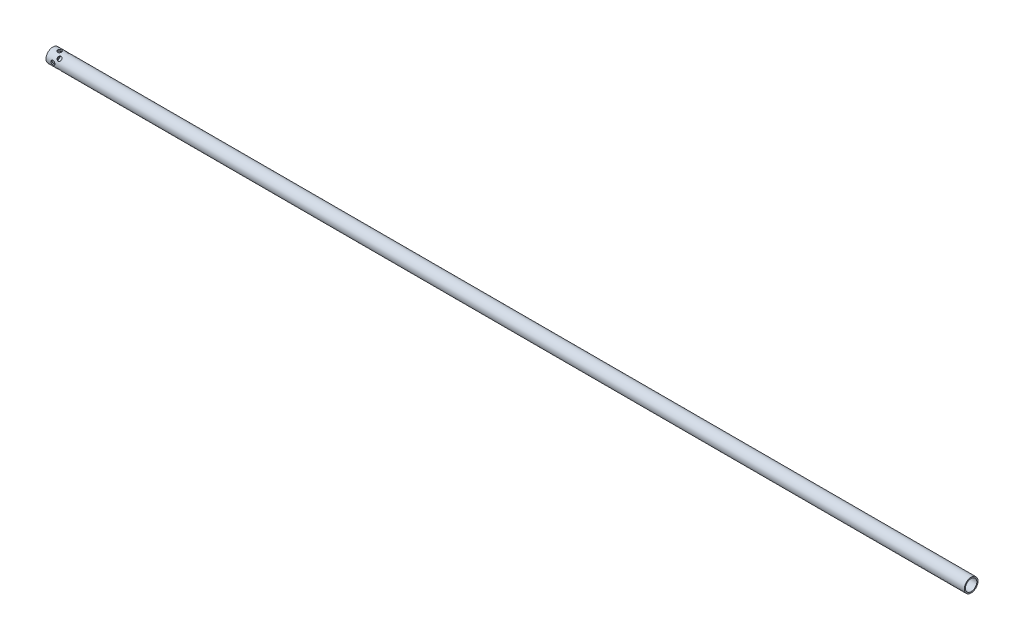
from build123d import *

# Parameters (mm, degrees)
SKETCH1_R           = 9.525
SKETCH1_R_2         = 7.874
BOSS_EXTRUDE1_DEPTH = 1270
BOSS_EXTRUDE2_START = -3.175
SKETCH2_R           = 9.525
BOSS_EXTRUDE2_DEPTH = 3.175
SKETCH3_R           = 2.778125
CUT_EXTRUDE1_DEPTH  = 12.7
CIRPATTERN1_COUNT   = 2
CIRPATTERN1_ANGLE   = 90
SKETCH4_R           = 2.778125
CUT_EXTRUDE2_DEPTH  = 12.7
CIRPATTERN2_COUNT   = 2
CIRPATTERN2_ANGLE   = 90


with BuildPart() as part:
    # Sketch1 → Boss-Extrude1 (new body)
    with BuildSketch(Plane(origin=(0, 0, 0), x_dir=(0, 0, -1), z_dir=(1, 0, 0))):
        with Locations(Location((0, 0, 0), (0, 0, 180))):
            Circle(SKETCH1_R)
        with Locations(Location((0, 0, 0), (0, 0, 180))):
            Circle(SKETCH1_R_2, mode=Mode.SUBTRACT)
    extrude(amount=BOSS_EXTRUDE1_DEPTH)

    # Sketch2 → Boss-Extrude2 (add)
    with BuildSketch(Plane(origin=(0, 0, 0), x_dir=(0, 0, -1), z_dir=(1, 0, 0)).offset(BOSS_EXTRUDE2_START)):
        with Locations(Location((0, 0, 0), (0, 0, 180))):
            Circle(SKETCH2_R)
    extrude(amount=BOSS_EXTRUDE2_DEPTH)

    # Sketch3 → Cut-Extrude1 (cut, symmetric)
    with BuildSketch(Plane.XY):
        with Locations((6.35, 0)):
            Circle(SKETCH3_R)
    cut_extrude1 = extrude(amount=CUT_EXTRUDE1_DEPTH, both=True, mode=Mode.SUBTRACT)

    # CirPattern1: Cut-Extrude1 ×2 about axis
    cirpattern1_axis = Axis((1270, 0, 0), (-1, 0, 0))
    for i in range(1, CIRPATTERN1_COUNT):
        add(cut_extrude1.rotate(cirpattern1_axis, i * CIRPATTERN1_ANGLE / (CIRPATTERN1_COUNT - 1)), mode=Mode.SUBTRACT)

    # Sketch4 → Cut-Extrude2 (cut, symmetric)
    with BuildSketch(Plane(origin=(0, 0, 0), x_dir=(1, 0, 0), z_dir=(0, -0.7071067811865488, 0.7071067811865464))):
        with Locations(Location((12.7, 0, 0), (0, 0, 270))):
            Circle(SKETCH4_R)
    cut_extrude2 = extrude(amount=CUT_EXTRUDE2_DEPTH, both=True, mode=Mode.SUBTRACT)

    # CirPattern2: Cut-Extrude2 ×2 about axis
    cirpattern2_axis = Axis((1270, 0, 0), (-1, 0, 0))
    for i in range(1, CIRPATTERN2_COUNT):
        add(cut_extrude2.rotate(cirpattern2_axis, i * CIRPATTERN2_ANGLE / (CIRPATTERN2_COUNT - 1)), mode=Mode.SUBTRACT)


solid = part.part
